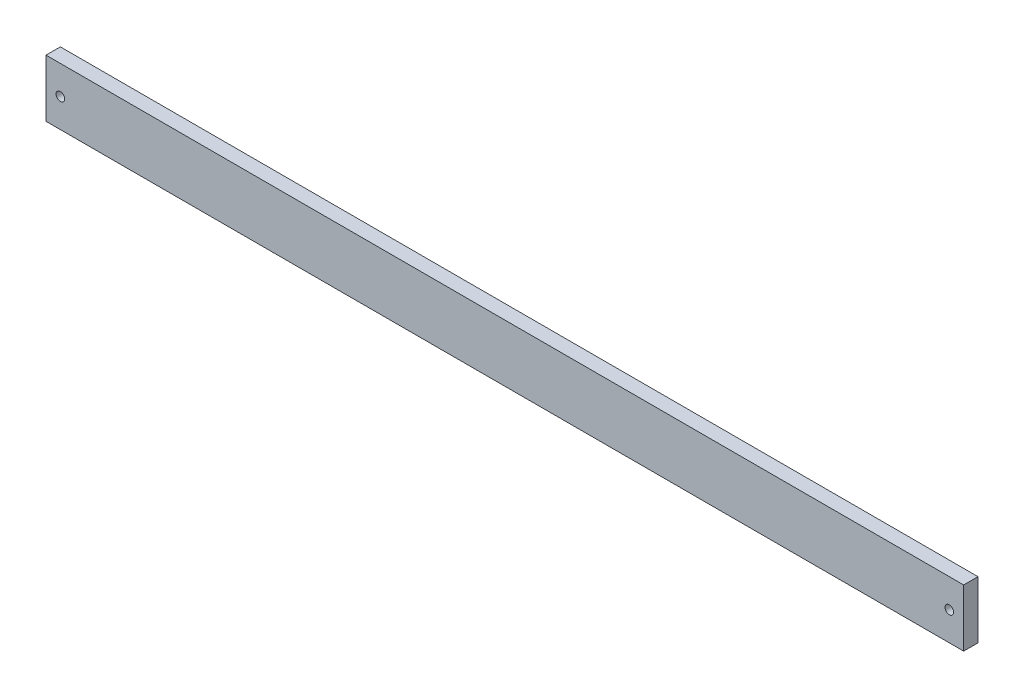
from build123d import *

# Parameters (mm, degrees)
SKETCH1_W           = 320
SKETCH1_H           = 20
BOSS_EXTRUDE1_DEPTH = 5
SKETCH2_R           = 1.5
CUT_EXTRUDE1_DEPTH  = 161.390149323


with BuildPart() as part:
    # Sketch1 → Boss-Extrude1 (new body)
    with BuildSketch(Plane.XY):
        Rectangle(SKETCH1_W, SKETCH1_H)
    extrude(amount=BOSS_EXTRUDE1_DEPTH)

    # Sketch2 → Cut-Extrude1 (cut, through all)
    with BuildSketch(Plane.XY.offset(5)):
        with Locations((-155, 0)):
            Circle(SKETCH2_R)
        with Locations(Location((155, 0, 0), (0, 0, 180))):
            Circle(SKETCH2_R)
    extrude(amount=-CUT_EXTRUDE1_DEPTH, mode=Mode.SUBTRACT)


solid = part.part
